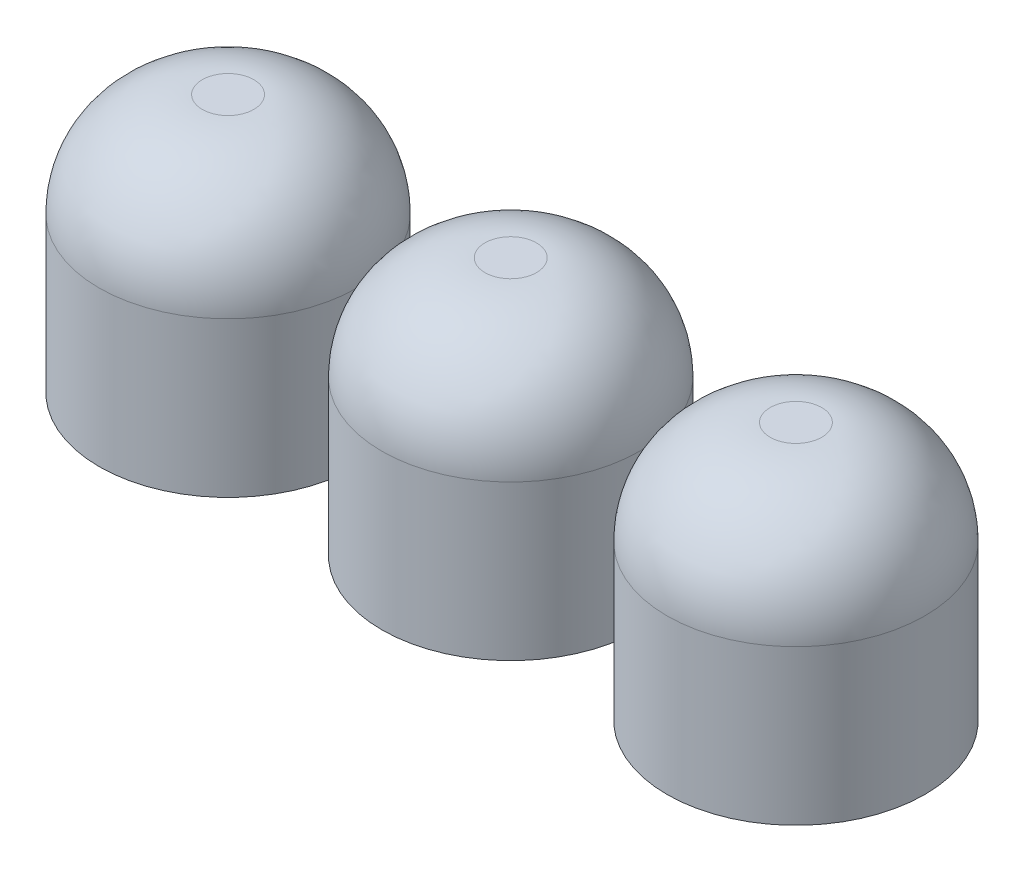
from build123d import *

# Parameters (mm, degrees)
SKETCH1_R             = 2.5
SKETCH1_R_2           = 2
BOSS_EXTRUDE1_DEPTH   = 5
BOSS_EXTRUDE1_2_DEPTH = 5
BOSS_EXTRUDE1_3_DEPTH = 5
SKETCH2_R             = 2
BOSS_EXTRUDE2_DEPTH   = 5
SKETCH3_R             = 2.05
CUT_EXTRUDE1_DEPTH    = 4
FILLET1_R             = 2
FILLET2_R             = 2
FILLET4_R             = 2


with BuildPart() as part:
    # Sketch1 → Boss-Extrude1 (new body)
    with BuildSketch(Plane(origin=(0, 0, 0), x_dir=(1, 0, 0), z_dir=(0, 1, 0))):
        with Locations(Location((-28.318080474, 2.436779788, 0), (0, 0, 270))):
            Circle(SKETCH1_R)
        with Locations(Location((-28.318080474, 2.436779788, 0), (0, 0, 270))):
            Circle(SKETCH1_R_2, mode=Mode.SUBTRACT)
    extrude(amount=BOSS_EXTRUDE1_DEPTH)



with BuildPart() as body_2:
    # Sketch1 → Boss-Extrude1 2 (new body)
    with BuildSketch(Plane(origin=(0, 0, 0), x_dir=(1, 0, 0), z_dir=(0, 1, 0))):
        with Locations(Location((-22.835920981, 2.436779788, 0), (0, 0, 270))):
            Circle(SKETCH1_R)
        with Locations(Location((-22.835920981, 2.436779788, 0), (0, 0, 270))):
            Circle(SKETCH1_R_2, mode=Mode.SUBTRACT)
    extrude(amount=BOSS_EXTRUDE1_2_DEPTH)


with BuildPart() as body_3:
    # Sketch1 → Boss-Extrude1 3 (new body)
    with BuildSketch(Plane(origin=(0, 0, 0), x_dir=(1, 0, 0), z_dir=(0, 1, 0))):
        with Locations(Location((-17.304081106, 2.436779788, 0), (0, 0, 270))):
            Circle(SKETCH1_R)
        with Locations(Location((-17.304081106, 2.436779788, 0), (0, 0, 270))):
            Circle(SKETCH1_R_2, mode=Mode.SUBTRACT)
    extrude(amount=BOSS_EXTRUDE1_3_DEPTH)


with BuildPart() as part_1:
    add(part.part)

    add(body_2.part)  # Boss-Extrude2 merges body 2

    add(body_3.part)  # Boss-Extrude2 merges body 3
    # Sketch2 → Boss-Extrude2 (add)
    with BuildSketch(Plane(origin=(0, 0, 0), x_dir=(1, 0, 0), z_dir=(0, 1, 0))):
        with Locations((-22.835920981, 2.436779788)):
            Circle(SKETCH2_R)
        with Locations((-17.304081106, 2.436779788)):
            Circle(SKETCH2_R)
        with Locations((-28.318080474, 2.436779788)):
            Circle(SKETCH2_R)
    extrude(amount=BOSS_EXTRUDE2_DEPTH)

    # Sketch3 → Cut-Extrude1 (cut)
    with BuildSketch(Plane(origin=(0, 0, 0), x_dir=(-1, 0, 0), z_dir=(0, -1, 0))):
        with Locations(Location((28.318080474, 2.436779788, 0), (0, 0, 90))):
            Circle(SKETCH3_R)
        with Locations(Location((22.835920981, 2.436779788, 0), (0, 0, 90))):
            Circle(SKETCH3_R)
        with Locations(Location((17.304081106, 2.436779788, 0), (0, 0, 90))):
            Circle(SKETCH3_R)
    extrude(amount=-CUT_EXTRUDE1_DEPTH, mode=Mode.SUBTRACT)

    # Fillet1
    fillet1_edges = [part_1.edges().sort_by_distance(p)[0] for p in [
        (-28.318080474, 5, -4.936779788),
    ]]
    fillet(fillet1_edges, radius=FILLET1_R)

    # Fillet2
    fillet2_edges = [part_1.edges().sort_by_distance(p)[0] for p in [
        (-22.835920981, 5, -4.936779788),
    ]]
    fillet(fillet2_edges, radius=FILLET2_R)

    # Fillet4
    fillet4_edges = [part_1.edges().sort_by_distance(p)[0] for p in [
        (-17.304081106, 5, -4.936779788),
    ]]
    fillet(fillet4_edges, radius=FILLET4_R)


solid = part_1.part
